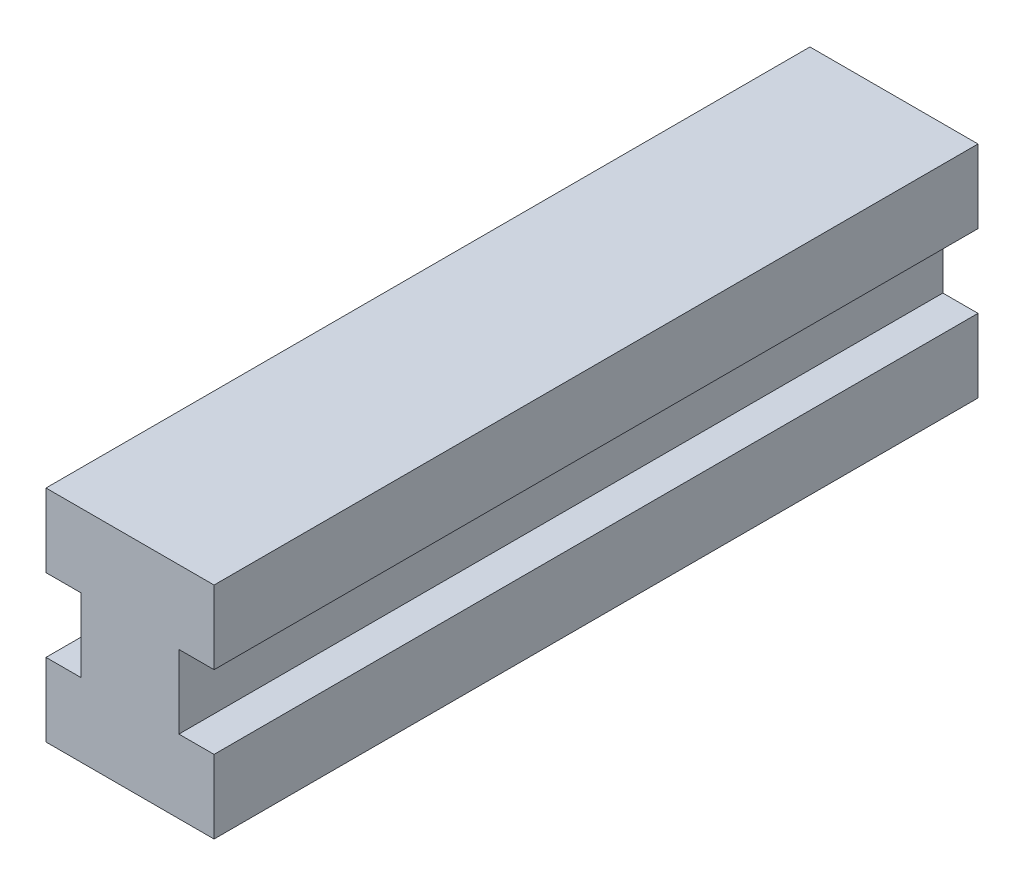
from build123d import *

# Parameters (mm, degrees)
BOSS_EXTRUDE1_DEPTH = 25


with BuildPart() as part:
    # Sketch1 → Boss-Extrude1 (new body)
    with BuildSketch(Plane.XY):
        Polygon((-2.75, 0), (2.75, 0), (2.75, 2.4), (1.6, 2.4), (1.6, 4.8), (2.75, 4.8), (2.75, 7.2), (-2.75, 7.2), (-2.75, 4.8), (-1.6, 4.8), (-1.6, 2.4), (-2.75, 2.4), align=None)
    extrude(amount=BOSS_EXTRUDE1_DEPTH)


solid = part.part
